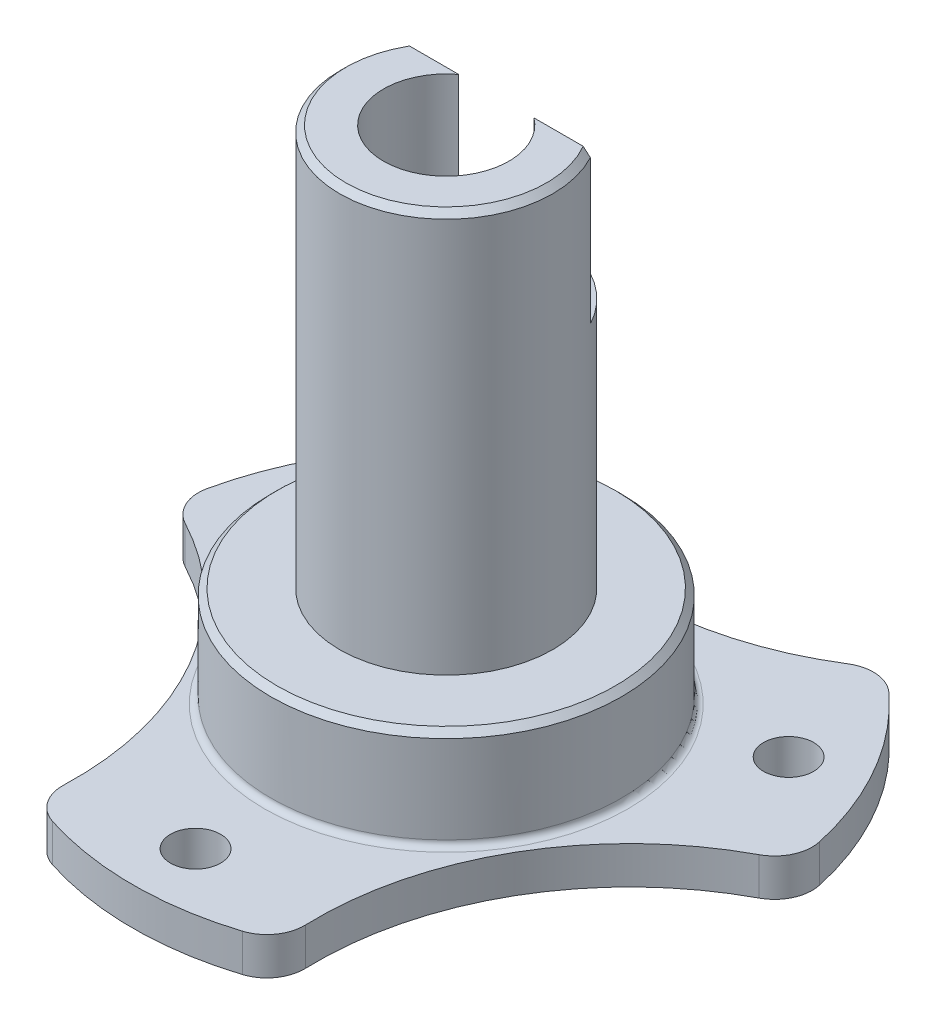
from build123d import *

# Parameters (mm, degrees)
SKETCH_2_R          = 14
EXTRUDE_1_DEPTH     = 8
SKETCH_3_R          = 8.5
EXTRUDE_2_DEPTH     = 20
SKETCH_4_R          = 5
CUT_EXTRUDE_1_DEPTH = 45
EXTRUDE_START       = -7
SKETCH_5_R          = 5
SKETCH_5_R_2        = 2.75
EXTRUDE_3_DEPTH     = 7
CUT_EXTRUDE_START   = -3.3
SKETCH_6_R          = 5
SKETCH_6_R_2        = 2.75
CUT_EXTRUDE_2_DEPTH = 3.3
EXTRUDE_4_DEPTH     = 6
SKETCH_9_R          = 6
CUT_EXTRUDE_5_DEPTH = 21
CHAMFER_5_SIZE      = 0.5
SKETCH_21_R         = 25
EXTRUDE_5_DEPTH     = 3
SKETCH_22_R         = 2.0000000000000004
SKETCH_22_R_2       = 25
SKETCH_22_R_3       = 2.0000000000000027
SKETCH_22_R_4       = 1.9999999999999996
SKETCH_22_R_5       = 25.000000000000004
CUT_EXTRUDE_7_DEPTH = 3
FILLET_2_R          = 3
FILLET_3_R          = 0.5
SKETCH_23_R         = 6
CUT_EXTRUDE_8_DEPTH = 3
CHAMFER_7_SIZE      = 0.5
EXTRUDE_6_DEPTH     = 6
CHAMFER_8_SIZE      = 0.5


with BuildPart() as part:
    # 草图2 → 凸台-拉伸1 (new body)
    with BuildSketch(Plane(origin=(0, 0, 0), x_dir=(1, 0, 0), z_dir=(0, 1, 0))):
        Circle(SKETCH_2_R)
    extrude(amount=EXTRUDE_1_DEPTH)

    # 草图3 → 凸台-拉伸2 (add)
    with BuildSketch(Plane(origin=(0, 8, 0), x_dir=(1, 0, 0), z_dir=(0, 1, 0))):
        Circle(SKETCH_3_R)
    extrude(amount=EXTRUDE_2_DEPTH)

    # 草图4 → 切除-拉伸1 (cut)
    with BuildSketch(Plane.XZ):
        Circle(SKETCH_4_R)
    extrude(amount=-CUT_EXTRUDE_1_DEPTH, mode=Mode.SUBTRACT)

    # 草图5 → 凸台-拉伸3 (add)
    with BuildSketch(Plane(origin=(0, 28, 0), x_dir=(1, 0, 0), z_dir=(0, 1, 0)).offset(EXTRUDE_START)):
        Circle(SKETCH_5_R)
        Circle(SKETCH_5_R_2, mode=Mode.SUBTRACT)
    extrude(amount=EXTRUDE_3_DEPTH)

    # 草图6 → 切除-拉伸2 (cut)
    with BuildSketch(Plane(origin=(0, 28, 0), x_dir=(1, 0, 0), z_dir=(0, 1, 0)).offset(CUT_EXTRUDE_START)):
        Circle(SKETCH_6_R)
        Circle(SKETCH_6_R_2, mode=Mode.SUBTRACT)
    extrude(amount=CUT_EXTRUDE_2_DEPTH, mode=Mode.SUBTRACT)

    # 草图8 → 凸台-拉伸4 (add)
    with BuildSketch(Plane(origin=(0, 28, 0), x_dir=(1, 0, 0), z_dir=(0, 1, 0))):
        with BuildLine():
            Line((-3.000000000000001, 4), (-7.500000000000001, 4))
            ThreePointArc((-7.500000000000001, 4), (8.9e-16, -8.5), (7.5, 4.000000000000002))
            Line((7.500000000000001, 4), (3.0000000000000027, 4))
            ThreePointArc((3.0000000000000018, 3.9999999999999982), (4.4721359549995805, 2.236067977499788), (5, -2.16e-15))
            ThreePointArc((5, -2.16e-15), (-2.2360679774997885, -4.472135954999579), (-3.000000000000001, 3.999999999999998))
        make_face()
    extrude(amount=EXTRUDE_4_DEPTH)

    # 草图9 → 切除-拉伸5 (cut)
    with BuildSketch(Plane.XZ):
        Circle(SKETCH_9_R)
    extrude(amount=-CUT_EXTRUDE_5_DEPTH, mode=Mode.SUBTRACT)

    # 倒角5
    chamfer_5_edges = [part.edges().sort_by_distance(p)[0] for p in [
        (-14, 8, -1.71e-15),
    ]]
    chamfer(chamfer_5_edges, length=CHAMFER_5_SIZE)

    # 草图21 → 凸台-拉伸5 (add)
    with BuildSketch(Plane.XZ):
        Circle(SKETCH_21_R)
    extrude(amount=EXTRUDE_5_DEPTH)

    # 草图22 → 切除-拉伸7 (cut)
    with BuildSketch(Plane.XZ.offset(3)):
        with Locations((0, 20)):
            Circle(SKETCH_22_R)
        with Locations((0, -40)):
            Circle(SKETCH_22_R_2)
        with Locations((17.320508075688732, -10.00000000000008)):
            Circle(SKETCH_22_R_3)
        with Locations((-34.641016151377464, 20.000000000000163)):
            Circle(SKETCH_22_R_2)
        with Locations((-17.32050807568886, -9.999999999999838)):
            Circle(SKETCH_22_R_4)
        with Locations((34.64101615137774, 19.999999999999677)):
            Circle(SKETCH_22_R_5)
    extrude(amount=-CUT_EXTRUDE_7_DEPTH, mode=Mode.SUBTRACT)

    # 圆角2
    fillet_2_edges = [part.edges().sort_by_distance(p)[0] for p in [
        (-24.820508075688785, -1.5, -2.9903810567664557),
        (-14.999999999999996, -1.5, -20),
        (14.999999999999996, -1.5, -20),
        (24.820508075688743, -1.5, -2.990381056766811),
        (9.820508075688991, -1.5, 22.990381056766484),
        (-9.820508075688677, -1.5, 22.99038105676662),
    ]]
    fillet(fillet_2_edges, radius=FILLET_2_R)

    # 圆角3
    fillet_3_edges = [part.edges().sort_by_distance(p)[0] for p in [
        (-14, 0, -1.71e-15),
    ]]
    fillet(fillet_3_edges, radius=FILLET_3_R)

    # 草图23 → 切除-拉伸8 (cut)
    with BuildSketch(Plane.XZ.offset(3)):
        Circle(SKETCH_23_R)
    extrude(amount=-CUT_EXTRUDE_8_DEPTH, mode=Mode.SUBTRACT)

    # 倒角7
    chamfer_7_edges = [part.edges().sort_by_distance(p)[0] for p in [
        (-6, -3, 7.3e-16),
    ]]
    chamfer(chamfer_7_edges, length=CHAMFER_7_SIZE)

    # 草图24 → 凸台-拉伸6 (add)
    with BuildSketch(Plane(origin=(0, 34, 0), x_dir=(1, 0, 0), z_dir=(0, 1, 0))):
        with BuildLine():
            Line((-7.500000000000001, 4), (-3.000000000000001, 3.9999999999999982))
            ThreePointArc((-3.000000000000001, 3.9999999999999982), (-9.2e-16, -4.999999999999999), (3.000000000000001, 3.9999999999999982))
            Line((3.000000000000001, 3.9999999999999982), (7.500000000000001, 4))
            ThreePointArc((7.500000000000001, 4), (-1.56e-15, -8.5), (-7.500000000000001, 4))
        make_face()
    extrude(amount=EXTRUDE_6_DEPTH)

    # 倒角8
    chamfer_8_edges = [part.edges().sort_by_distance(p)[0] for p in [
        (-8.9e-16, 40, 8.5),
    ]]
    chamfer(chamfer_8_edges, length=CHAMFER_8_SIZE)


solid = part.part
